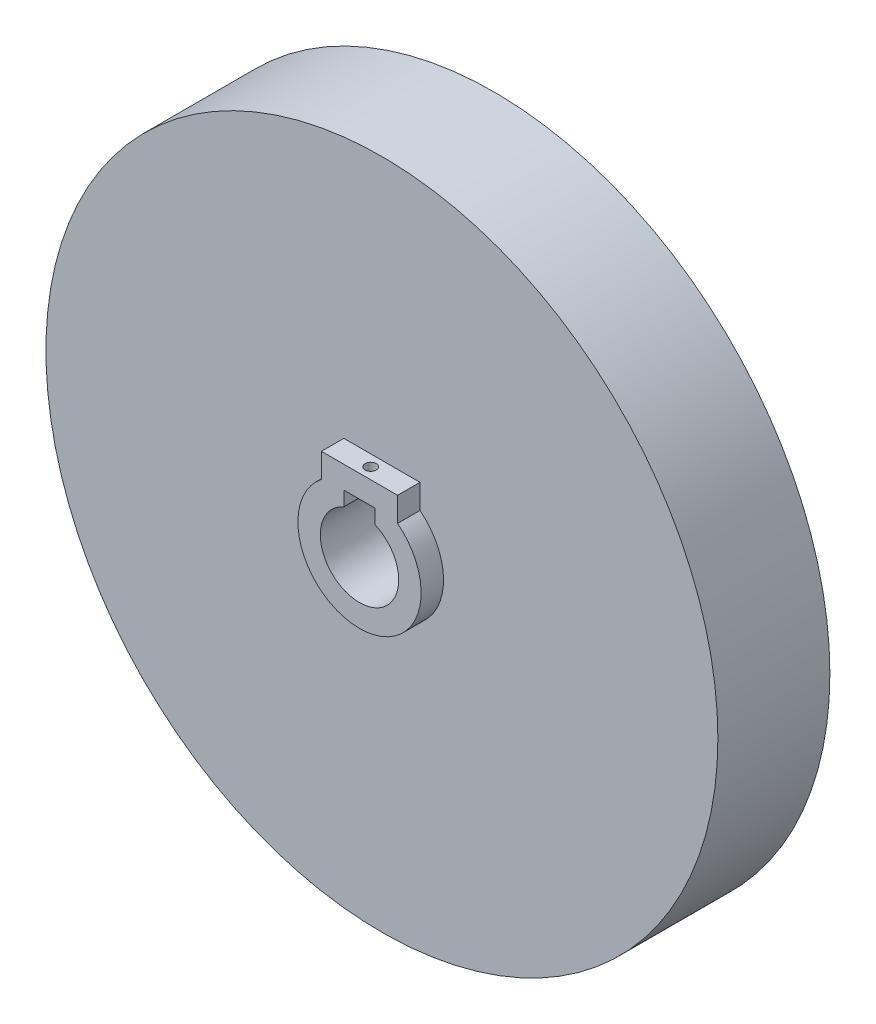
from build123d import *

# Parameters (mm, degrees)
SKETCH1_R                = 150
BOSS_EXTRUDE1_DEPTH      = 50
BOSS_EXTRUDE2_DEPTH      = 10
BOSS_EXTRUDE2_DEPTH_BACK = 60
SKETCH3_R                = 2.5
CUT_EXTRUDE1_DEPTH       = 10


with BuildPart() as part:
    # Sketch1 → Boss-Extrude1 (new body)
    with BuildSketch(Plane.XY):
        Circle(SKETCH1_R)
        with BuildLine():
            Line((-7, 22.5), (7, 22.5))
            Line((7, 22.5), (7, 16.039014932))
            ThreePointArc((7, 16.039014932), (0, -17.5), (-7, 16.039014932))
            Line((-7, 16.039014932), (-7, 22.5))
        make_face(mode=Mode.SUBTRACT)
    extrude(amount=BOSS_EXTRUDE1_DEPTH)

    # Sketch2 → Boss-Extrude2 (add, two sides: drawn at the far end of the back side and taken through both)
    with BuildSketch(Plane.XY.offset(50).offset(-BOSS_EXTRUDE2_DEPTH_BACK)):
        with BuildLine():
            Line((17, 21.615966321), (17, 32.5))
            Line((17, 32.5), (-17, 32.5))
            Line((-17, 32.5), (-17, 21.615966321))
            ThreePointArc((-17, 21.615966321), (0, -27.5), (17, 21.615966321))
        make_face()
        with BuildLine():
            Line((7, 16.039014932), (7, 22.5))
            Line((7, 22.5), (-7, 22.5))
            Line((-7, 22.5), (-7, 16.039014932))
            ThreePointArc((-7, 16.039014932), (0, -17.5), (7, 16.039014932))
        make_face(mode=Mode.SUBTRACT)
    extrude(amount=BOSS_EXTRUDE2_DEPTH + BOSS_EXTRUDE2_DEPTH_BACK)

    # Sketch3 → Cut-Extrude1 (cut)
    with BuildSketch(Plane(origin=(0, 32.5, 0), x_dir=(1, 0, 0), z_dir=(0, 1, 0))):
        with Locations(Location((0, -55, 0), (0, 0, 270))):
            Circle(SKETCH3_R)
    extrude(amount=-CUT_EXTRUDE1_DEPTH, mode=Mode.SUBTRACT)


solid = part.part
